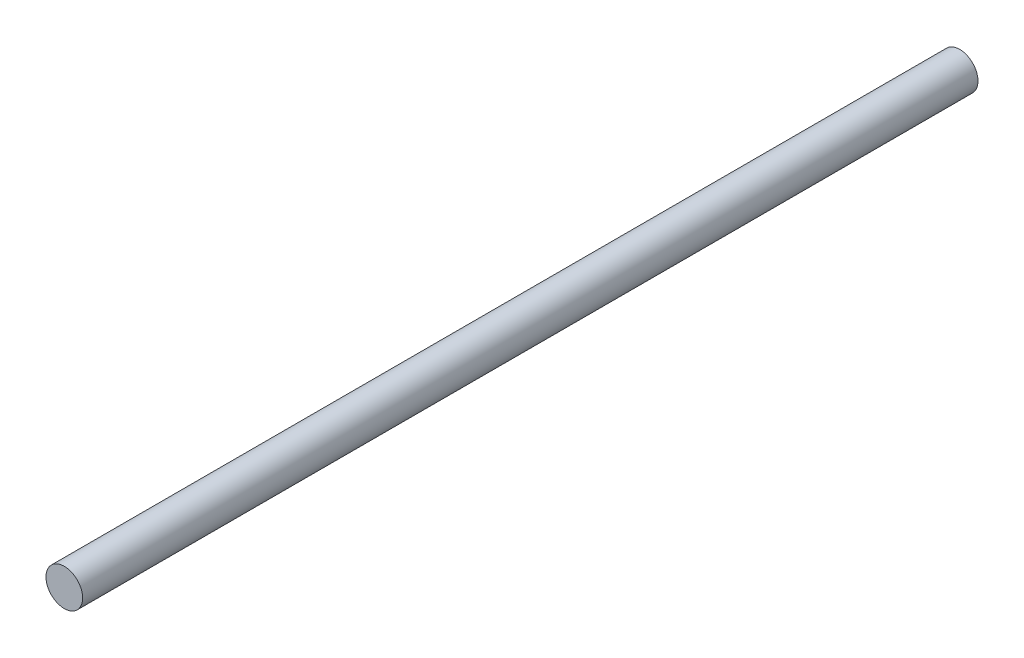
from build123d import *

# Parameters (mm, degrees)
SKETCH2_R           = 2.15
BOSS_EXTRUDE1_DEPTH = 105


with BuildPart() as part:
    # Sketch2 → Boss-Extrude1 (new body)
    with BuildSketch(Plane.XY):
        Circle(SKETCH2_R)
    extrude(amount=BOSS_EXTRUDE1_DEPTH)


solid = part.part
